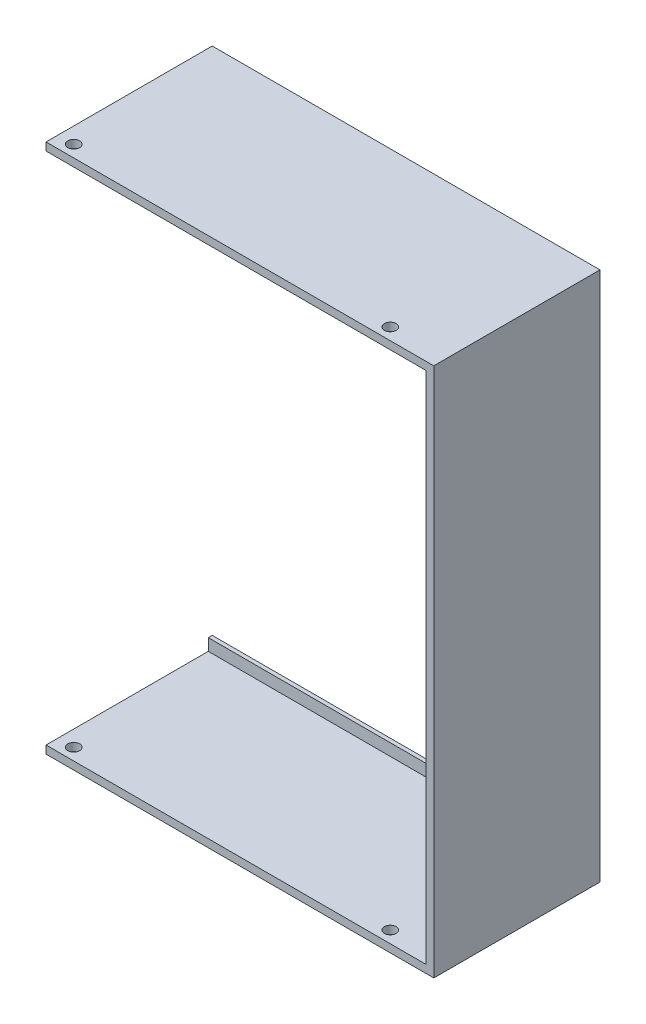
from build123d import *

# Parameters (mm, degrees)
SKETCH1_W           = 98
SKETCH1_H           = 6
SKETCH1_R           = 1.5
BOSS_EXTRUDE1_DEPTH = 2
SKETCH2_W           = 2
SKETCH2_H           = 6
BOSS_EXTRUDE2_DEPTH = 130
SKETCH3_W           = 98
SKETCH3_H           = 6
SKETCH3_R           = 1.5
BOSS_EXTRUDE3_DEPTH = 2
BOSS_EXTRUDE4_DEPTH = 35
BOSS_EXTRUDE5_DEPTH = 1


with BuildPart() as part:
    # Sketch1 → Boss-Extrude1 (new body)
    with BuildSketch(Plane(origin=(0, 0, 0), x_dir=(1, 0, 0), z_dir=(0, 1, 0))):
        with Locations((45, 0)):
            Rectangle(SKETCH1_W, SKETCH1_H)
        with Locations(Location((0, 0, 0), (0, 0, 270))):
            Circle(SKETCH1_R, mode=Mode.SUBTRACT)
        with Locations(Location((80, 0, 0), (0, 0, 270))):
            Circle(SKETCH1_R, mode=Mode.SUBTRACT)
    extrude(amount=BOSS_EXTRUDE1_DEPTH)

    # Sketch2 → Boss-Extrude2 (add)
    with BuildSketch(Plane(origin=(0, 2, 0), x_dir=(1, 0, 0), z_dir=(0, 1, 0))):
        with Locations((93, 0)):
            Rectangle(SKETCH2_W, SKETCH2_H)
    extrude(amount=BOSS_EXTRUDE2_DEPTH)

    # Sketch3 → Boss-Extrude3 (add)
    with BuildSketch(Plane(origin=(0, 132, 0), x_dir=(1, 0, 0), z_dir=(0, 1, 0))):
        with Locations((45, 0)):
            Rectangle(SKETCH3_W, SKETCH3_H)
        with Locations(Location((0, 0, 0), (0, 0, 270))):
            Circle(SKETCH3_R, mode=Mode.SUBTRACT)
        with Locations(Location((80, 0, 0), (0, 0, 270))):
            Circle(SKETCH3_R, mode=Mode.SUBTRACT)
    extrude(amount=BOSS_EXTRUDE3_DEPTH)

    # Sketch4 → Boss-Extrude4 (add)
    with BuildSketch(Plane(origin=(0, 0, -3), x_dir=(-1, 0, 0), z_dir=(0, 0, -1))):
        Polygon((4, 0), (-92, 0), (-94, 0), (-94, 134), (-92, 134), (4, 134), (4, 132), (-92, 132), (-92, 2), (4, 2), align=None)
    extrude(amount=BOSS_EXTRUDE4_DEPTH)

    # Sketch5 → Boss-Extrude5 (add)
    with BuildSketch(Plane(origin=(0, 0, -38), x_dir=(-1, 0, 0), z_dir=(0, 0, -1))):
        Polygon((4, 0), (-94, 0), (-94, 5), (-94, 126), (-94, 134), (4, 134), (4, 129), (-89, 129), (-89, 5), (4, 5), align=None)
    extrude(amount=BOSS_EXTRUDE5_DEPTH)


solid = part.part
